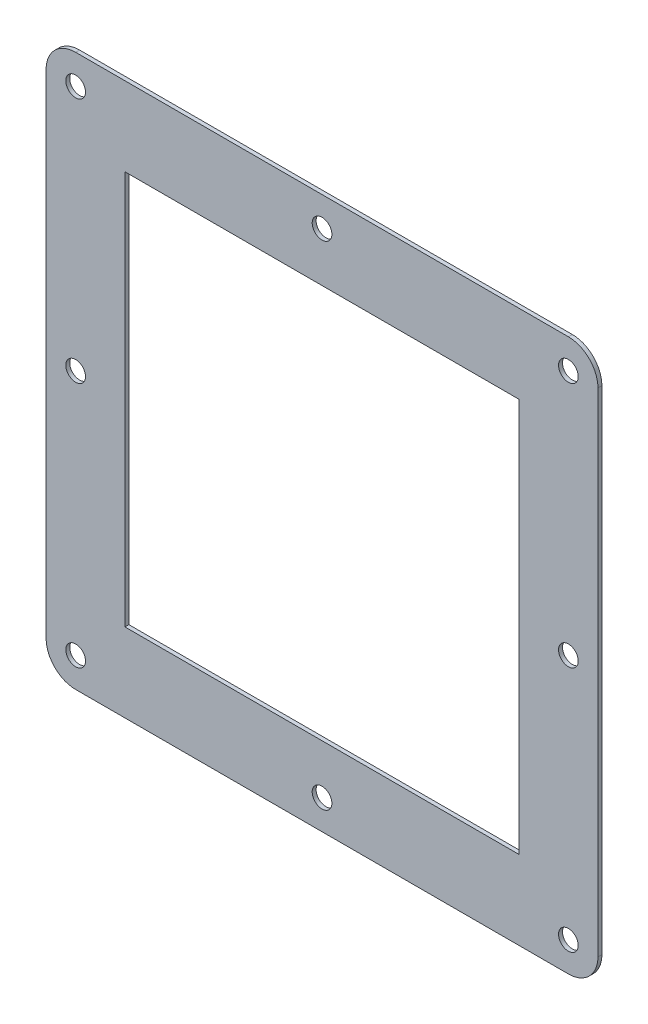
from build123d import *

# Parameters (mm, degrees)
SKETCH2_R           = 5
SKETCH2_R_2         = 4
BOSS_EXTRUDE1_DEPTH = 2
SKETCH3_W           = 200
SKETCH3_H           = 200
CUT_EXTRUDE1_DEPTH  = 10


with BuildPart() as part:
    # Sketch2 → Boss-Extrude1 (new body)
    with BuildSketch(Plane.XY):
        with BuildLine():
            Line((-125, 140), (125, 140))
            ThreePointArc((125, 140), (135.606601718, 135.606601718), (140, 125))
            Line((140, 125), (140, -125))
            ThreePointArc((140, -125), (135.606601718, -135.606601718), (125, -140))
            Line((125, -140), (-125, -140))
            ThreePointArc((-125, -140), (-135.606601718, -135.606601718), (-140, -125))
            Line((-140, -125), (-140, 125))
            ThreePointArc((-140, 125), (-135.606601718, 135.606601718), (-125, 140))
        make_face()
        with Locations((-125, 125)):
            Circle(SKETCH2_R, mode=Mode.SUBTRACT)
        with Locations((0, 125)):
            Circle(SKETCH2_R, mode=Mode.SUBTRACT)
        with Locations((125, 125)):
            Circle(SKETCH2_R, mode=Mode.SUBTRACT)
        Circle(SKETCH2_R_2, mode=Mode.SUBTRACT)
        with Locations((125, 0)):
            Circle(SKETCH2_R, mode=Mode.SUBTRACT)
        with Locations((-125, 0)):
            Circle(SKETCH2_R, mode=Mode.SUBTRACT)
        with Locations((-125, -125)):
            Circle(SKETCH2_R, mode=Mode.SUBTRACT)
        with Locations((0, -125)):
            Circle(SKETCH2_R, mode=Mode.SUBTRACT)
        with Locations((125, -125)):
            Circle(SKETCH2_R, mode=Mode.SUBTRACT)
    extrude(amount=BOSS_EXTRUDE1_DEPTH)

    # Sketch3 → Cut-Extrude1 (cut)
    with BuildSketch(Plane.XY.offset(2)):
        Rectangle(SKETCH3_W, SKETCH3_H)
    extrude(amount=-CUT_EXTRUDE1_DEPTH, mode=Mode.SUBTRACT)


solid = part.part
